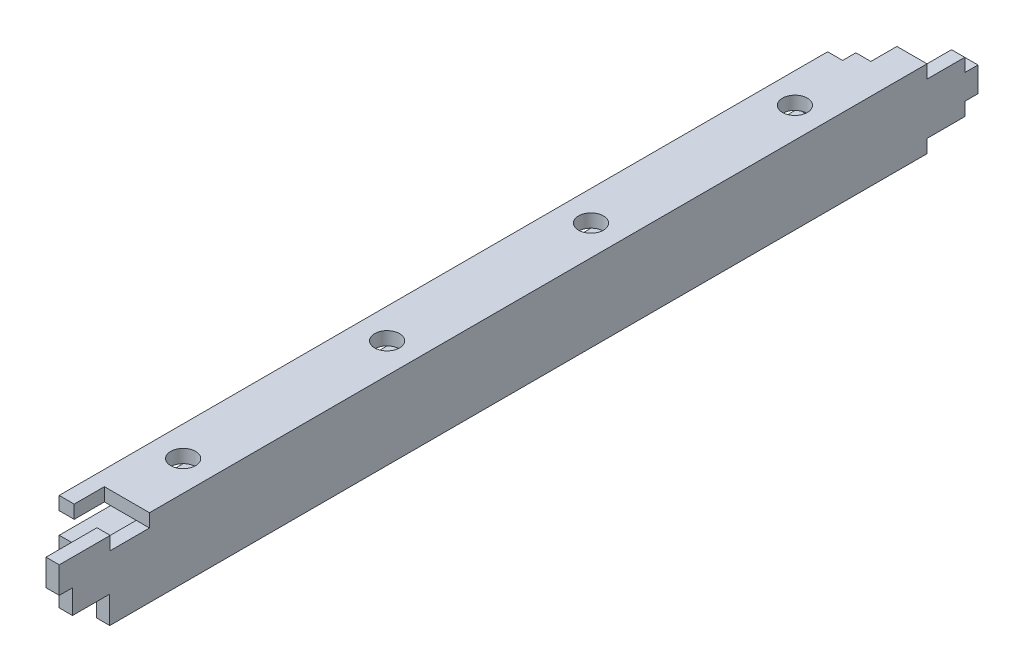
from build123d import *

# Parameters (mm, degrees)
EXTRUDE4_DEPTH     = 114.43
CUT_EXTRUDE1_DEPTH = 116.389135104
SKETCH3_R          = 1.55
CUT_EXTRUDE2_DEPTH = 1.65
CUT_EXTRUDE3_DEPTH = 3.4
SKETCH5_W          = 1.65
SKETCH5_H          = 3
CUT_EXTRUDE4_DEPTH = 1.65


with BuildPart() as part:
    # Sketch1 → Extrude4 (new body)
    with BuildSketch(Plane.XY):
        Polygon((0, 0), (11.24, 0), (11.24, 9.7), (0, 9.7), (0, 8.05), (9.59, 8.05), (9.59, 1.65), (0, 1.65), align=None)
    extrude(amount=EXTRUDE4_DEPTH)

    # Sketch2 → Cut-Extrude1 (cut, through all)
    with BuildSketch(Plane(origin=(11.24, 0, 0), x_dir=(0, 0, -1), z_dir=(1, 0, 0))):
        Polygon((-6.35, 1.65), (-1.65, 1.65), (-1.65, 3.3), (0, 3.3), (0, 0), (-6.35, 0), align=None)
        Polygon((0, 9.7), (-6.35, 9.7), (-6.35, 8.05), (-1.65, 8.05), (-1.65, 6.4), (0, 6.4), align=None)
    extrude(amount=-CUT_EXTRUDE1_DEPTH, mode=Mode.SUBTRACT)

    # Sketch3 → Cut-Extrude2 (cut)
    with BuildSketch(Plane(origin=(0, 9.7, 0), x_dir=(-1, 0, 0), z_dir=(0, 1, 0))):
        with Locations((-7.49, 19.05)):
            Circle(SKETCH3_R)
        with Locations((-7.49, 44.45)):
            Circle(SKETCH3_R)
        with Locations((-7.49, 69.85)):
            Circle(SKETCH3_R)
        with Locations((-7.49, 95.25)):
            Circle(SKETCH3_R)
        Polygon((0, 6.35), (0, 114.43), (-9.59, 114.43), (-9.59, 108.08), (-11.24, 108.08), (-11.24, 103.19), (-5.62, 103.19), (-5.62, 106.95), (-3.75, 106.95), (-3.75, 11.24), (-5.62, 11.24), (-5.62, 9.59), (-7.49, 9.59), (-7.49, 6.35), align=None)
    extrude(amount=-CUT_EXTRUDE2_DEPTH, mode=Mode.SUBTRACT)

    # Sketch4 → Cut-Extrude3 (cut)
    with BuildSketch(Plane.XZ):
        Polygon((7.49, 6.35), (7.49, 9.2), (5.62, 9.2), (5.62, 11.24), (0, 11.24), (0, 6.35), align=None)
        Polygon((0, 103.19), (9.59, 103.19), (9.59, 104.84), (6.35, 104.84), (6.35, 106.49), (9.59, 106.49), (9.59, 108.14), (11.24, 108.14), (11.24, 114.43), (0, 114.43), align=None)
    extrude(amount=-CUT_EXTRUDE3_DEPTH, mode=Mode.SUBTRACT)

    # Sketch5 → Cut-Extrude4 (cut)
    with BuildSketch(Plane(origin=(11.24, 0, 0), x_dir=(0, 0, -1), z_dir=(1, 0, 0))):
        with Locations((-113.605, 4.9)):
            Rectangle(SKETCH5_W, SKETCH5_H)
    extrude(amount=-CUT_EXTRUDE4_DEPTH, mode=Mode.SUBTRACT)


solid = part.part
